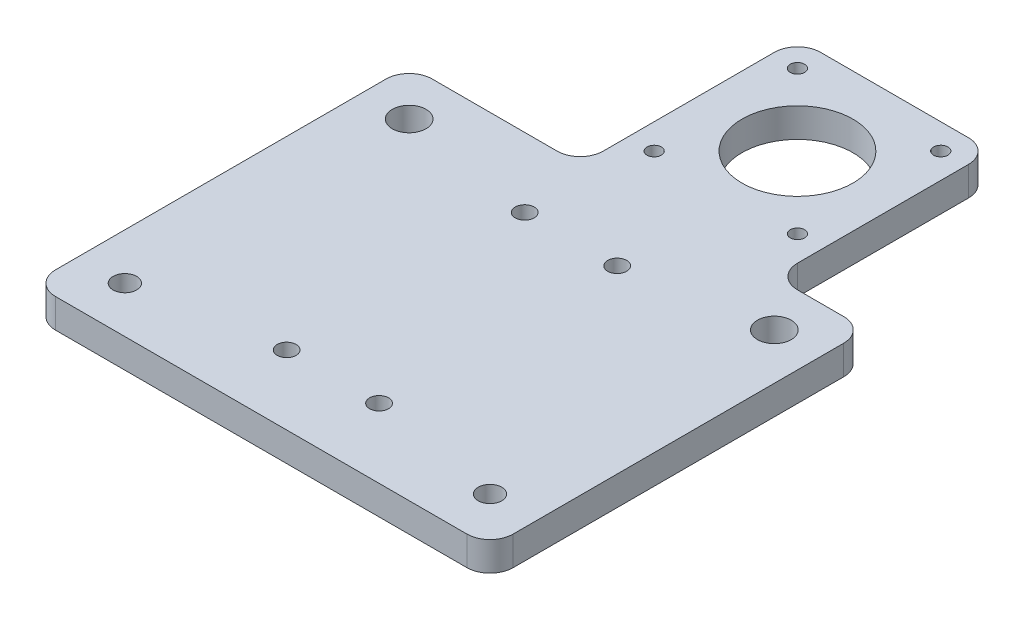
from build123d import *

# Parameters (mm, degrees)
SKETCH1_R           = 12
SKETCH1_R_2         = 1.55
SKETCH1_R_3         = 3.65
SKETCH1_R_4         = 2.55
SKETCH1_R_5         = 2.05
BOSS_EXTRUDE1_DEPTH = 6.3
FILLET1_R           = 5


with BuildPart() as part:
    # Sketch1 → Boss-Extrude1 (new body)
    with BuildSketch(Plane(origin=(0, 0, 0), x_dir=(1, 0, 0), z_dir=(0, 1, 0))):
        Polygon((0, 0), (99, 0), (99, 81.5), (79, 81.5), (79, 128.5), (37, 128.5), (37, 81.5), (0, 81.5), align=None)
        with Locations(Location((58, 107.5, 0), (0, 0, 270))):
            Circle(SKETCH1_R, mode=Mode.SUBTRACT)
        with Locations(Location((42.5, 123, 0), (0, 0, 270))):
            Circle(SKETCH1_R_2, mode=Mode.SUBTRACT)
        with Locations(Location((73.5, 123, 0), (0, 0, 270))):
            Circle(SKETCH1_R_2, mode=Mode.SUBTRACT)
        with Locations(Location((73.5, 92, 0), (0, 0, 270))):
            Circle(SKETCH1_R_2, mode=Mode.SUBTRACT)
        with Locations(Location((42.5, 92, 0), (0, 0, 270))):
            Circle(SKETCH1_R_2, mode=Mode.SUBTRACT)
        with Locations(Location((10, 71.5, 0), (0, 0, 270))):
            Circle(SKETCH1_R_3, mode=Mode.SUBTRACT)
        with Locations(Location((89, 71.5, 0), (0, 0, 270))):
            Circle(SKETCH1_R_3, mode=Mode.SUBTRACT)
        with Locations(Location((89, 10, 0), (0, 0, 270))):
            Circle(SKETCH1_R_4, mode=Mode.SUBTRACT)
        with Locations(Location((10, 10, 0), (0, 0, 270))):
            Circle(SKETCH1_R_4, mode=Mode.SUBTRACT)
        with Locations(Location((40, 66.5, 0), (0, 0, 270))):
            Circle(SKETCH1_R_5, mode=Mode.SUBTRACT)
        with Locations(Location((60, 66.5, 0), (0, 0, 270))):
            Circle(SKETCH1_R_5, mode=Mode.SUBTRACT)
        with Locations(Location((60, 15, 0), (0, 0, 270))):
            Circle(SKETCH1_R_5, mode=Mode.SUBTRACT)
        with Locations(Location((40, 15, 0), (0, 0, 270))):
            Circle(SKETCH1_R_5, mode=Mode.SUBTRACT)
    extrude(amount=BOSS_EXTRUDE1_DEPTH)

    # Fillet1
    fillet1_edges = [part.edges().sort_by_distance(p)[0] for p in [
        (0, 3.15, -81.5),
        (37, 3.15, -81.5),
        (37, 3.15, -128.5),
        (79, 3.15, -128.5),
        (79, 3.15, -81.5),
        (99, 3.15, -81.5),
        (99, 3.15, 0),
        (0, 3.15, 0),
    ]]
    fillet(fillet1_edges, radius=FILLET1_R)


solid = part.part
